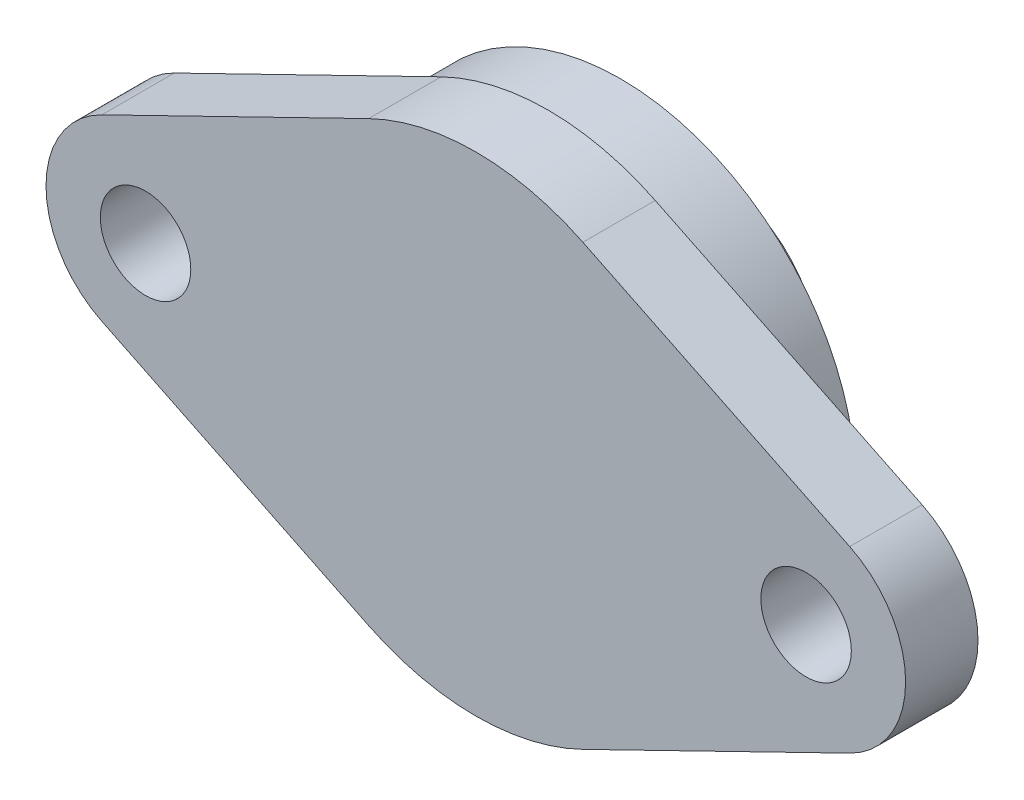
from build123d import *

# Parameters (mm, degrees)
SKETCH1_R               = 2.5
BOSS_EXTRUDE1_DEPTH     = 4
SKETCH2_R               = 13
SKETCH2_R_2             = 11
EXTRUDE_THIN1_DEPTH     = 4
SKETCH3_R               = 6
SKETCH3_R_2             = 4
EXTRUDE_THIN2_DEPTH     = 9
CUT_EXTRUDE1_DEPTH      = 29.763040521
CUT_EXTRUDE1_DEPTH_BACK = 29.763040521
SKETCH4_R               = 0.75
CUT_EXTRUDE2_DEPTH      = 29.763040552
CUT_EXTRUDE2_DEPTH_BACK = 29.763040552
SKETCH5_R               = 0.75


with BuildPart() as part:
    # Sketch1 → Boss-Extrude1 (new body)
    with BuildSketch(Plane.XY):
        with BuildLine():
            Line((-20.660958904, 4.943407445), (-5.917808219, 12.133818273))
            ThreePointArc((-5.917808219, 12.133818273), (0, 13.5), (5.917808219, 12.133818273))
            Line((5.917808219, 12.133818273), (20.660958904, 4.943407445))
            ThreePointArc((20.660958904, 4.943407445), (23.75, 0), (20.660958904, -4.943407445))
            Line((20.660958904, -4.943407445), (5.917808219, -12.133818273))
            ThreePointArc((5.917808219, -12.133818273), (0, -13.5), (-5.917808219, -12.133818273))
            Line((-5.917808219, -12.133818273), (-20.660958904, -4.943407445))
            ThreePointArc((-20.660958904, -4.943407445), (-23.75, 0), (-20.660958904, 4.943407445))
        make_face()
        with Locations((-18.25, 0)):
            Circle(SKETCH1_R, mode=Mode.SUBTRACT)
        with Locations((18.25, 0)):
            Circle(SKETCH1_R, mode=Mode.SUBTRACT)
    extrude(amount=BOSS_EXTRUDE1_DEPTH)

    # Sketch2 → Extrude-Thin1 (add)
    with BuildSketch(Plane(origin=(0, 0, 0), x_dir=(-1, 0, 0), z_dir=(0, 0, -1))):
        Circle(SKETCH2_R)
        Circle(SKETCH2_R_2, mode=Mode.SUBTRACT)
    extrude(amount=EXTRUDE_THIN1_DEPTH)

    # Sketch3 → Extrude-Thin2 (add)
    with BuildSketch(Plane(origin=(0, 0, 0), x_dir=(-1, 0, 0), z_dir=(0, 0, -1))):
        Circle(SKETCH3_R)
        Circle(SKETCH3_R_2, mode=Mode.SUBTRACT)
    extrude(amount=EXTRUDE_THIN2_DEPTH)

    # Sketch4 → Cut-Extrude1 (cut, two sides: drawn at the far end of the back side and taken through both)
    with BuildSketch(Plane(origin=(0, 0, 0), x_dir=(0, 0, -1), z_dir=(1, 0, 0)).offset(-CUT_EXTRUDE1_DEPTH_BACK)):
        with Locations((7, 0)):
            Circle(SKETCH4_R)
    extrude(amount=CUT_EXTRUDE1_DEPTH + CUT_EXTRUDE1_DEPTH_BACK, mode=Mode.SUBTRACT)

    # Sketch5 → Cut-Extrude2 (cut, two sides: drawn at the far end of the back side and taken through both)
    with BuildSketch(Plane(origin=(0, 0, 0), x_dir=(1, 0, 0), z_dir=(0, 1, 0)).offset(-CUT_EXTRUDE2_DEPTH_BACK)):
        with Locations(Location((0, 7, 0), (0, 0, 270))):
            Circle(SKETCH5_R)
    extrude(amount=CUT_EXTRUDE2_DEPTH + CUT_EXTRUDE2_DEPTH_BACK, mode=Mode.SUBTRACT)


solid = part.part
